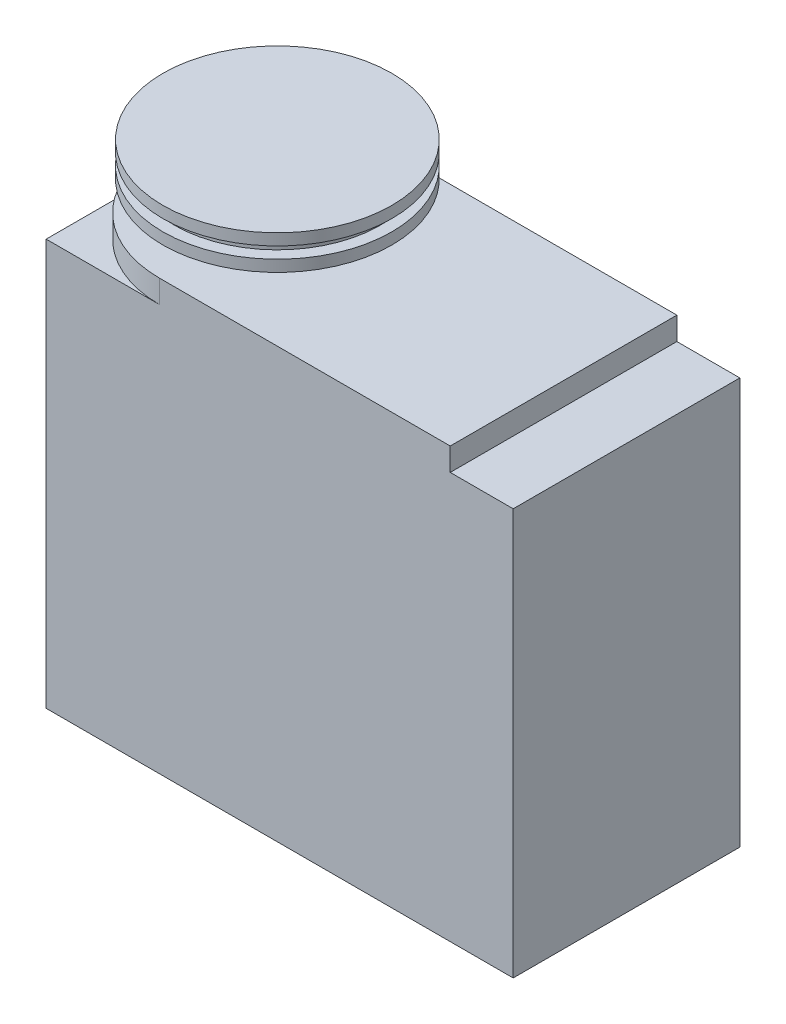
from build123d import *

# Parameters (mm, degrees)
SKETCH1_W            = 40.8
SKETCH1_H            = 19.8
BOSS_EXTRUDE1_DEPTH  = 35.5
BOSS_EXTRUDE2_DEPTH  = 2
SKETCH2_R            = 6
BOSS_EXTRUDE3_DEPTH  = 1.752137049
SKETCH5_R            = 6
BOSS_EXTRUDE4_DEPTH  = 1.75
SKETCH6_R            = 2.5
BOSS_EXTRUDE5_DEPTH  = 3.5
SKETCH7_R            = 2.75
BOSS_EXTRUDE6_DEPTH  = 1
SKETCH8_W            = 7
SKETCH8_H            = 4
BOSS_EXTRUDE7_DEPTH  = 5
SKETCH10_R           = 10
BOSS_EXTRUDE9_DEPTH  = 1
SKETCH14_R           = 9
BOSS_EXTRUDE10_DEPTH = 1
SKETCH15_R           = 10
BOSS_EXTRUDE11_DEPTH = 1


with BuildPart() as part:
    # Sketch1 → Boss-Extrude1 (new body)
    with BuildSketch(Plane(origin=(0, 0, 0), x_dir=(1, 0, 0), z_dir=(0, 1, 0))):
        Rectangle(SKETCH1_W, SKETCH1_H)
    extrude(amount=BOSS_EXTRUDE1_DEPTH)

    # Sketch4 → Boss-Extrude2 (add)
    with BuildSketch(Plane(origin=(0, 35.5, 0), x_dir=(1, 0, 0), z_dir=(0, 1, 0))):
        with BuildLine():
            Line((14.9, 9.9), (14.9, -9.9))
            Line((14.9, -9.9), (-10.5, -9.9))
            ThreePointArc((-10.5, -9.9), (-20.4, 0), (-10.5, 9.9))
            Line((-10.5, 9.9), (14.9, 9.9))
        make_face()
    extrude(amount=BOSS_EXTRUDE2_DEPTH)

    # Sketch5 → Boss-Extrude4 (add)
    with BuildSketch(Plane(origin=(0, 37.5, 0), x_dir=(1, 0, 0), z_dir=(0, 1, 0))):
        with Locations(Location((-10.1, 0, 0), (0, 0, 90))):
            Circle(SKETCH5_R)
    extrude(amount=BOSS_EXTRUDE4_DEPTH)

    # Sketch7 → Boss-Extrude6 (add)
    with BuildSketch(Plane(origin=(0, 39.25, 0), x_dir=(1, 0, 0), z_dir=(0, 1, 0))):
        with Locations(Location((-10.1, 0, 0), (0, 0, 270))):
            Circle(SKETCH7_R)
    extrude(amount=BOSS_EXTRUDE6_DEPTH)

    # Sketch8 → Boss-Extrude7 (add)
    with BuildSketch(Plane.ZY.offset(20.4)):
        with Locations((0, 5)):
            Rectangle(SKETCH8_W, SKETCH8_H)
    extrude(amount=BOSS_EXTRUDE7_DEPTH)

    # Sketch10 → Boss-Extrude9 (add)
    with BuildSketch(Plane(origin=(0, 40.25, 0), x_dir=(1, 0, 0), z_dir=(0, 1, 0))):
        with Locations(Location((-10.1, 0, 0), (0, 0, 270))):
            Circle(SKETCH10_R)
    extrude(amount=BOSS_EXTRUDE9_DEPTH)

    # Sketch14 → Boss-Extrude10 (add)
    with BuildSketch(Plane(origin=(0, 41.25, 0), x_dir=(1, 0, 0), z_dir=(0, 1, 0))):
        with Locations(Location((-10.1, 0, 0), (0, 0, 270))):
            Circle(SKETCH14_R)
    extrude(amount=BOSS_EXTRUDE10_DEPTH)

    # Sketch15 → Boss-Extrude11 (add)
    with BuildSketch(Plane(origin=(0, 42.25, 0), x_dir=(1, 0, 0), z_dir=(0, 1, 0))):
        with Locations(Location((-10.1, 0, 0), (0, 0, 270))):
            Circle(SKETCH15_R)
    extrude(amount=BOSS_EXTRUDE11_DEPTH)


with BuildPart() as body_2:
    # Sketch2 → Boss-Extrude3 (new body)
    with BuildSketch(Plane.XZ):
        with Locations(Location((-10.1, 0, 0), (0, 0, 270))):
            Circle(SKETCH2_R)
    extrude(amount=BOSS_EXTRUDE3_DEPTH)

    # Sketch6 → Boss-Extrude5 (add)
    with BuildSketch(Plane.XZ.offset(1.752137049)):
        with Locations(Location((-10.1, 0, 0), (0, 0, 270))):
            Circle(SKETCH6_R)
    extrude(amount=BOSS_EXTRUDE5_DEPTH)


solid = Compound([part.part, body_2.part])
